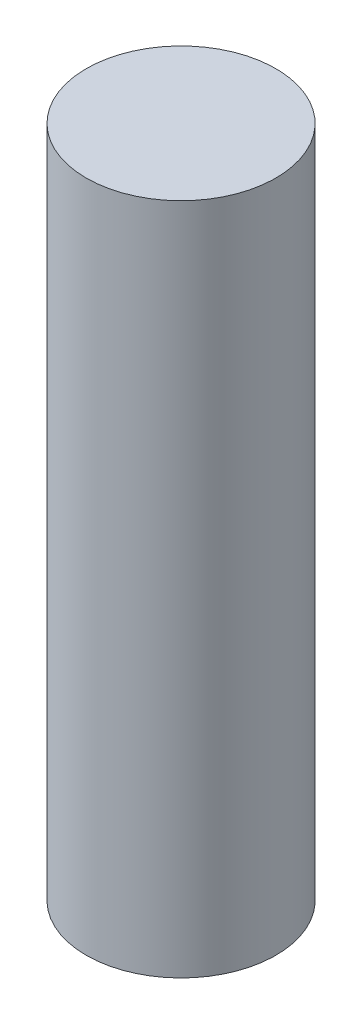
from build123d import *

# Parameters (mm, degrees)
SKETCH1_R           = 1
BOSS_EXTRUDE1_DEPTH = 7.1


with BuildPart() as part:
    # Sketch1 → Boss-Extrude1 (new body)
    with BuildSketch(Plane(origin=(0, 0, 0), x_dir=(1, 0, 0), z_dir=(0, 1, 0))):
        with Locations(Location((0, 0, 0), (0, 0, 270))):
            Circle(SKETCH1_R)
    extrude(amount=BOSS_EXTRUDE1_DEPTH)


solid = part.part
